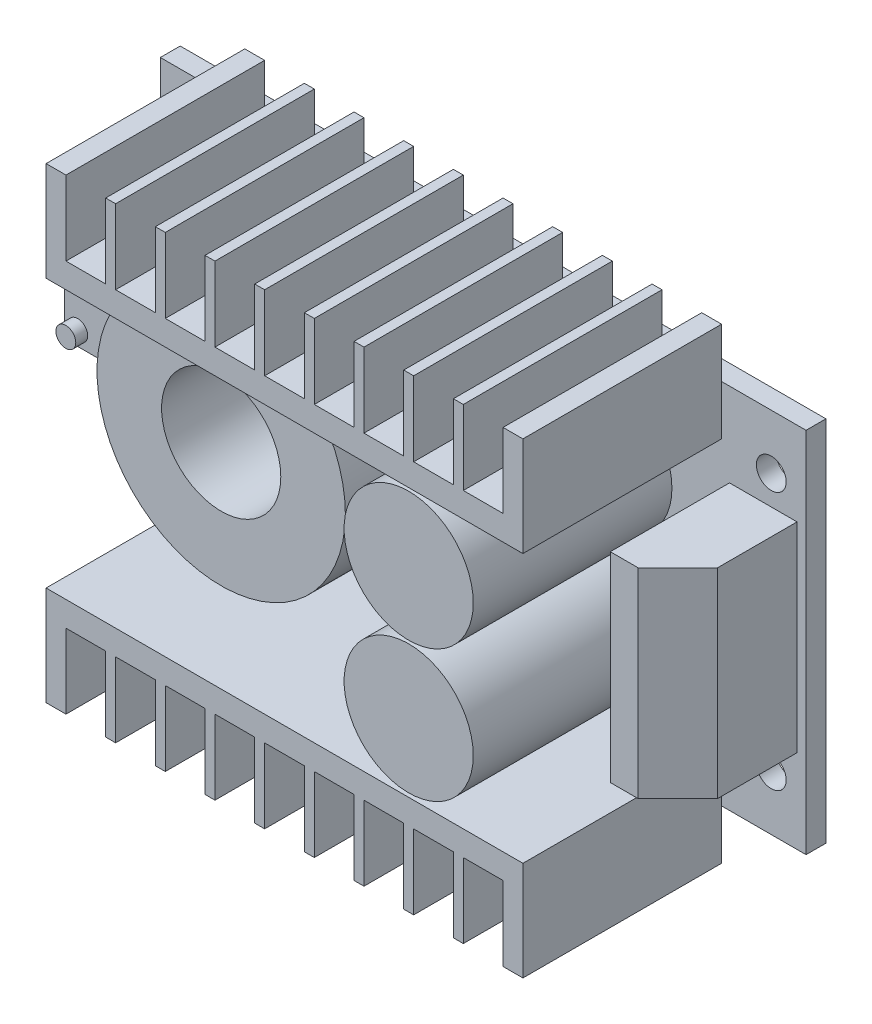
from build123d import *

# Parameters (mm, degrees)
SKETCH_1_W          = 65
SKETCH_1_H          = 37
EXTRUDE_1_DEPTH     = 2
EXTRUDE_2_DEPTH     = 20
SKETCH_3_R          = 6.5
EXTRUDE_3_DEPTH     = 20
SKETCH_4_R          = 12.5
SKETCH_4_R_2        = 6
EXTRUDE_4_DEPTH     = 12
SKETCH_5_W          = 5
SKETCH_5_H          = 10
EXTRUDE_5_DEPTH     = 10
SKETCH_6_R          = 1
EXTRUDE_6_DEPTH     = 1.2
SKETCH_7_W          = 6.798722996
SKETCH_7_H          = 20.12306807
EXTRUDE_7_DEPTH     = 12
CHAMFER_1_SIZE      = 4
SKETCH_8_R          = 1.5
CUT_EXTRUDE_1_DEPTH = 45.816291681


with BuildPart() as part:
    # Эскиз1 → Бобышка-Вытянуть1 (new body)
    with BuildSketch(Plane.XY):
        Rectangle(SKETCH_1_W, SKETCH_1_H)
    extrude(amount=EXTRUDE_1_DEPTH)

    # Эскиз2 → Бобышка-Вытянуть2 (add)
    with BuildSketch(Plane.XY.offset(2)):
        Polygon((-24, 23.5), (-24, 13.5), (24, 13.5), (24, 23.5), (22, 23.5), (22, 16), (18, 16), (18, 23.5), (17, 23.5), (17, 16), (13, 16), (13, 23.5), (12, 23.5), (12, 16), (8, 16), (8, 23.5), (7, 23.5), (7, 16), (3, 16), (3, 23.5), (2, 23.5), (2, 16), (-2, 16), (-2, 23.5), (-3, 23.5), (-3, 16), (-7, 16), (-7, 23.5), (-8, 23.5), (-8, 16), (-12, 16), (-12, 23.5), (-13, 23.5), (-13, 16), (-17, 16), (-17, 23.5), (-18, 23.5), (-18, 16), (-22, 16), (-22, 23.5), align=None)
        Polygon((22, -23.5), (24, -23.5), (24, -13.5), (-24, -13.5), (-24, -23.5), (-22, -23.5), (-22, -16), (-18, -16), (-18, -23.5), (-17, -23.5), (-17, -16), (-13, -16), (-13, -23.5), (-12, -23.5), (-12, -16), (-8, -16), (-8, -23.5), (-7, -23.5), (-7, -16), (-3, -16), (-3, -23.5), (-2, -23.5), (-2, -16), (2, -16), (2, -23.5), (3, -23.5), (3, -16), (7, -16), (7, -23.5), (8, -23.5), (8, -16), (12, -16), (12, -23.5), (13, -23.5), (13, -16), (17, -16), (17, -23.5), (18, -23.5), (18, -16), (22, -16), align=None)
    extrude(amount=EXTRUDE_2_DEPTH)

    # Эскиз3 → Бобышка-Вытянуть3 (add)
    with BuildSketch(Plane.XY.offset(2)):
        with Locations((12.5, 6.691570058)):
            Circle(SKETCH_3_R)
        with Locations((12.5, -6.612413993)):
            Circle(SKETCH_3_R)
    extrude(amount=EXTRUDE_3_DEPTH)

    # Эскиз4 → Бобышка-Вытянуть4 (add)
    with BuildSketch(Plane.XY.offset(2)):
        with Locations((-14.373526478, 0)):
            Circle(SKETCH_4_R)
        with Locations((-14.373526478, 0)):
            Circle(SKETCH_4_R_2, mode=Mode.SUBTRACT)
    extrude(amount=EXTRUDE_4_DEPTH)

    # Эскиз5 → Бобышка-Вытянуть5 (add)
    with BuildSketch(Plane.XY.offset(2)):
        with Locations((-29.649429854, 4.142703247)):
            Rectangle(SKETCH_5_W, SKETCH_5_H)
    extrude(amount=EXTRUDE_5_DEPTH)

    # Эскиз6 → Бобышка-Вытянуть6 (add)
    with BuildSketch(Plane.XY.offset(12)):
        with Locations((-30.813495229, 0.582032688)):
            Circle(SKETCH_6_R)
    extrude(amount=EXTRUDE_6_DEPTH)

    # Эскиз7 → Бобышка-Вытянуть7 (add)
    with BuildSketch(Plane.XY.offset(2)):
        with Locations((28.195350692, 0)):
            Rectangle(SKETCH_7_W, SKETCH_7_H)
    extrude(amount=EXTRUDE_7_DEPTH)

    # Фаска1
    chamfer_1_edges = [part.edges().sort_by_distance(p)[0] for p in [
        (31.59471219, 0, 14),
    ]]
    chamfer(chamfer_1_edges, length=CHAMFER_1_SIZE)

    # Эскиз8 → Вырез-Вытянуть1 (cut, through all)
    with BuildSketch(Plane.XY.offset(2)):
        with Locations((-29, 13)):
            Circle(SKETCH_8_R)
        with Locations((29, 13)):
            Circle(SKETCH_8_R)
        with Locations((29, -13)):
            Circle(SKETCH_8_R)
        with Locations((-29, -13)):
            Circle(SKETCH_8_R)
    extrude(amount=-CUT_EXTRUDE_1_DEPTH, mode=Mode.SUBTRACT)


solid = part.part
